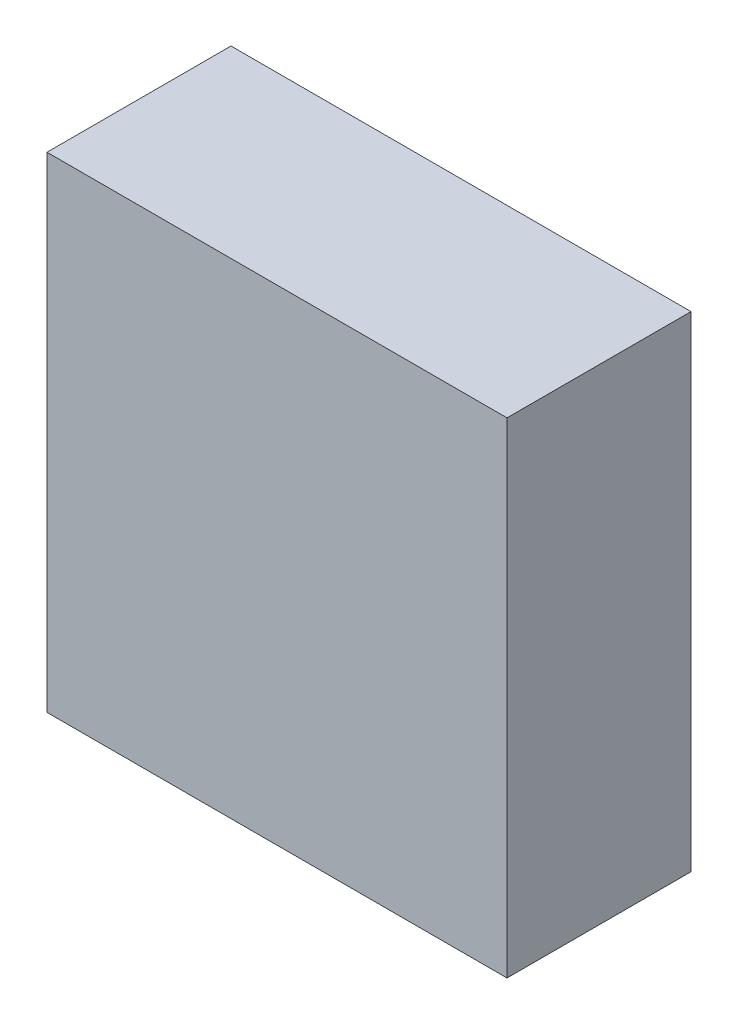
from build123d import *

# Parameters (mm, degrees)
SKETCH1_W           = 55
SKETCH1_H           = 58
BOSS_EXTRUDE1_DEPTH = 22
SKETCH2_W           = 51
SKETCH2_H           = 54
CUT_EXTRUDE2_DEPTH  = 20


with BuildPart() as part:
    # Sketch1 → Boss-Extrude1 (new body)
    with BuildSketch(Plane.XY):
        Rectangle(SKETCH1_W, SKETCH1_H)
    extrude(amount=BOSS_EXTRUDE1_DEPTH)

    # Sketch2 → Cut-Extrude2 (cut)
    with BuildSketch(Plane.XY):
        Rectangle(SKETCH2_W, SKETCH2_H)
    extrude(amount=CUT_EXTRUDE2_DEPTH, mode=Mode.SUBTRACT)


solid = part.part
